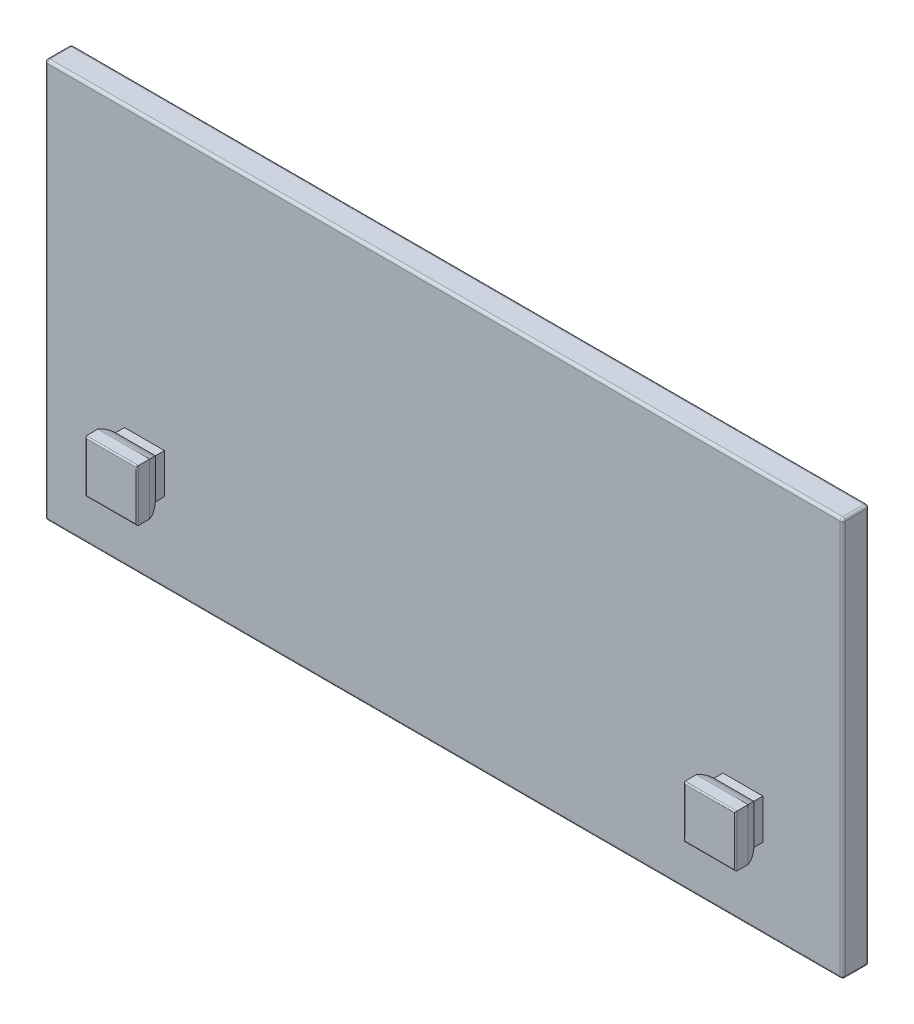
from build123d import *

# Parameters (mm, degrees)
SKETCH_1_W          = 60
SKETCH_1_H          = 30
EXTRUDE_1_DEPTH     = 2
SKETCH_2_W          = 3
SKETCH_2_H          = 3
EXTRUDE_2_DEPTH     = 1
EXTRUDE_START       = -4
EXTRUDE_3_DEPTH     = 5
CUT_EXTRUDE_1_REACH = 60.969
FILLET_1_R          = 0.1
FILLET_2_R          = 0.2


with BuildPart() as part:
    # 草图1 → 凸台-拉伸1 (new body)
    with BuildSketch(Plane.XY):
        with Locations((0, 7.5)):
            Rectangle(SKETCH_1_W, SKETCH_1_H)
    extrude(amount=-EXTRUDE_1_DEPTH)

    # 草图2 → 凸台-拉伸2 (add)
    with BuildSketch(Plane.XY):
        with Locations((-22.5, 0)):
            Rectangle(SKETCH_2_W, SKETCH_2_H)
    extrude_2 = extrude(amount=EXTRUDE_2_DEPTH)

    # 草图3 → 凸台-拉伸3 (add)
    with BuildSketch(Plane.XZ.offset(1.5).offset(EXTRUDE_START)):
        with BuildLine():
            Line((-24.45, 2.5), (-20.55, 2.5))
            Line((-20.55, 2.5), (-20.55, 1.555590279))
            ThreePointArc((-20.55, 1.555590279), (-20.719957697, 1.088161527), (-21, 0.677124344))
            Line((-21, 0.677124344), (-24, 0.677124344))
            ThreePointArc((-24, 0.677124344), (-24.280042303, 1.088161527), (-24.45, 1.555590279))
            Line((-24.45, 1.555590279), (-24.45, 2.5))
        make_face()
    extrude_3 = extrude(amount=EXTRUDE_3_DEPTH)

    # 草图4 → 切除-拉伸1 (cut, up to next)
    with BuildSketch(Plane.ZY.offset(24.45), mode=Mode.PRIVATE) as cut_extrude_1_sk1:
        with BuildLine():
            Line((2.5, 1.95), (1.555590279, 1.95))
            ThreePointArc((1.555590279, 1.95), (1.088161527, 1.780042303), (0.677124344, 1.5))
            Line((0.677124344, 1.5), (0.677124344, 2.5))
            Line((0.677124344, 2.5), (2.5, 2.5))
            Line((2.5, 2.5), (2.5, 1.95))
        make_face()
    cut_extrude_1_tool1 = extrude(cut_extrude_1_sk1.sketch, amount=-CUT_EXTRUDE_1_REACH, mode=Mode.PRIVATE) & part.part
    # 草图4 → 切除-拉伸1 (cut, up to next)
    with BuildSketch(Plane.ZY.offset(24.45), mode=Mode.PRIVATE) as cut_extrude_1_sk2:
        with BuildLine():
            Line((0.677124344, -2.5), (2.5, -2.5))
            Line((2.5, -2.5), (2.5, -1.95))
            Line((2.5, -1.95), (1.555590279, -1.95))
            ThreePointArc((1.555590279, -1.95), (1.088161527, -1.780042303), (0.677124344, -1.5))
            Line((0.677124344, -1.5), (0.677124344, -2.5))
        make_face()
    cut_extrude_1_tool2 = extrude(cut_extrude_1_sk2.sketch, amount=-CUT_EXTRUDE_1_REACH, mode=Mode.PRIVATE) & part.part
    cut_extrude_1_1 = cut_extrude_1_tool1.solids().sort_by_distance((-24.45, 2.169375, 1.500125))[0]
    add(cut_extrude_1_1, mode=Mode.SUBTRACT)
    cut_extrude_1_2 = cut_extrude_1_tool2.solids().sort_by_distance((-24.45, -2.169375, 1.500125))[0]
    add(cut_extrude_1_2, mode=Mode.SUBTRACT)
    cut_extrude_1 = cut_extrude_1_1 + cut_extrude_1_2  # 切除-拉伸1 as one shape, for the pattern or mirror that repeats it

    # 镜向1: 凸台-拉伸2, 凸台-拉伸3, 切除-拉伸1 across plane
    add(extrude_2.mirror(Plane(origin=(0, 0, 0), x_dir=(0, 0, 1), z_dir=(1, 0, 0))))
    add(extrude_3.mirror(Plane(origin=(0, 0, 0), x_dir=(0, 0, 1), z_dir=(1, 0, 0))))
    add(cut_extrude_1.mirror(Plane(origin=(0, 0, 0), x_dir=(0, 0, 1), z_dir=(1, 0, 0))), mode=Mode.SUBTRACT)

    # 圆角1
    fillet_1_edges = [part.edges().sort_by_distance(p)[0] for p in [
        (22.5, -1.95, 2.5),
        (24.45, 0, 2.5),
        (20.55, 0, 2.5),
        (22.5, 1.95, 2.5),
        (-22.5, -1.95, 2.5),
        (-20.55, 0, 2.5),
        (-24.45, 0, 2.5),
        (-22.5, 1.95, 2.5),
    ]]
    fillet(fillet_1_edges, radius=FILLET_1_R)

    # 圆角2
    fillet_2_edges = [part.edges().sort_by_distance(p)[0] for p in [
        (30, 7.5, -2),
        (0, 22.5, -2),
        (-30, 7.5, -2),
        (0, 22.5, 0),
        (30, 7.5, 0),
        (0, -7.5, 0),
        (-30, 7.5, 0),
        (0, -7.5, -2),
        (-30, 22.5, -1),
        (30, 22.5, -1),
        (30, -7.5, -1),
        (-30, -7.5, -1),
    ]]
    fillet(fillet_2_edges, radius=FILLET_2_R)


solid = part.part
